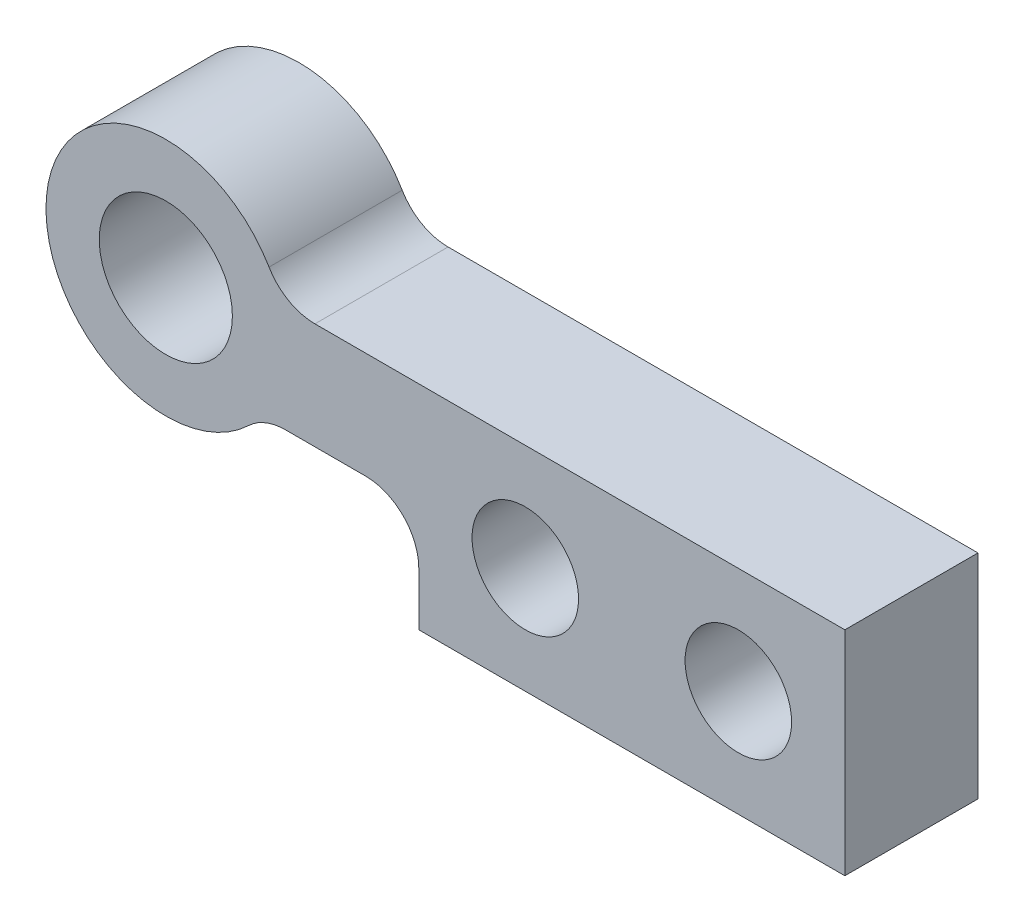
from build123d import *

# Parameters (mm, degrees)
SKETCH1_R           = 2
BOSS_EXTRUDE1_DEPTH = 5
FILLET1_R           = 2


with BuildPart() as part:
    # Sketch1 → Boss-Extrude1 (new body)
    with BuildSketch(Plane.XY):
        with BuildLine():
            Line((8, 4), (-13.191868154, 4))
            ThreePointArc((-13.191868154, 4), (-21.931098884, 3.484450558), (-13.9, 0))
            Line((-13.9, 0), (-8, 0))
            Line((-8, 0), (-8, -4))
            Line((-8, -4), (8, -4))
            Line((8, -4), (8, 4))
        make_face()
        with Locations((-4, 0)):
            Circle(SKETCH1_R, mode=Mode.SUBTRACT)
        with Locations((4, 0)):
            Circle(SKETCH1_R, mode=Mode.SUBTRACT)
        with BuildLine():
            ThreePointArc((-20, 2.7), (-17.5, 5.2), (-15, 2.7))
            ThreePointArc((-15, 2.7), (-17.5, 0.2), (-20, 2.7))
        make_face(mode=Mode.SUBTRACT)
    extrude(amount=BOSS_EXTRUDE1_DEPTH)

    # Fillet1
    fillet1_edges = [part.edges().sort_by_distance(p)[0] for p in [
        (-13.9, 0, 2.5),
        (-8, 0, 2.5),
        (-13.191868154, 4, 2.5),
    ]]
    fillet(fillet1_edges, radius=FILLET1_R)


solid = part.part
